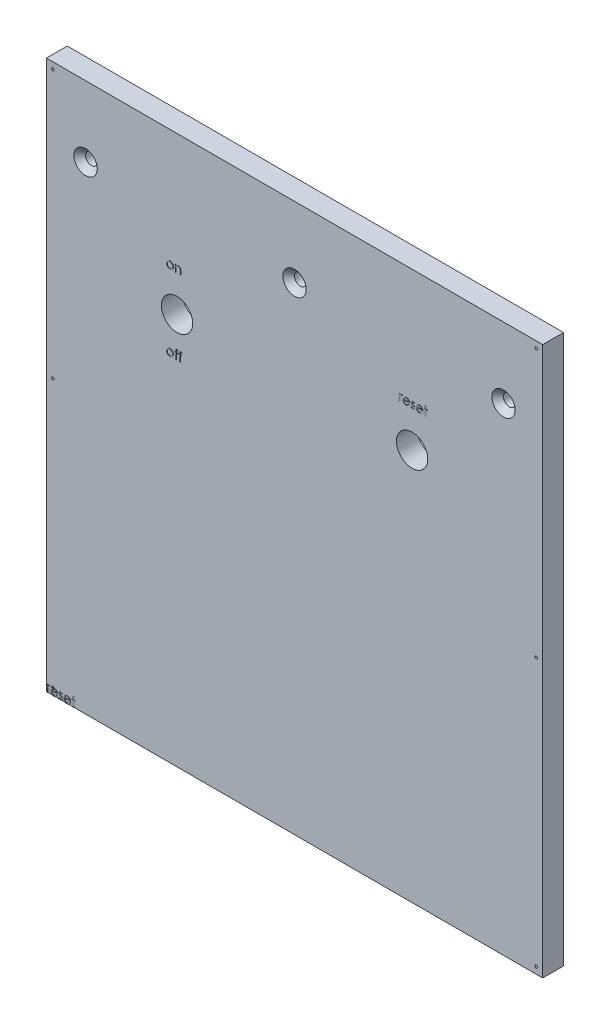
from build123d import *

# Parameters (mm, degrees)
ESBO_O1_W                            = 190
ESBO_O1_H                            = 210
RESSALTO_EXTRUS_O1_DEPTH             = 8
ESBO_O2_R                            = 6
CORTE_EXTRUS_O1_DEPTH                = 284.309018565
FURO_DE_DI_METRO_1_0_1_1_D           = 1
ESCAREADO_PARA_SFHCS_M41_D           = 4.5
ESCAREADO_PARA_SFHCS_M41_CSINK_D     = 8.96
ESCAREADO_PARA_SFHCS_M41_CSINK_ANGLE = 90
RESSALTO_EXTRUS_O3_DEPTH             = 0.1


with BuildPart() as part:
    # Esboço1 → Ressalto-extrusão1 (new body)
    with BuildSketch(Plane.XY):
        with Locations((95, 105)):
            Rectangle(ESBO_O1_W, ESBO_O1_H)
    extrude(amount=RESSALTO_EXTRUS_O1_DEPTH)

    # Esboço2 → Corte-extrusão1 (cut, through all)
    with BuildSketch(Plane.XY.offset(8)):
        with Locations((50, 150)):
            Circle(ESBO_O2_R)
        with Locations((140, 150)):
            Circle(ESBO_O2_R)
    extrude(amount=-CORTE_EXTRUS_O1_DEPTH, mode=Mode.SUBTRACT)

    # Furo de diâmetro Ø1.0 (1)1 (through all)
    with Locations(Plane(origin=(2.5, 207.5, 8), x_dir=(1, 0, 0), z_dir=(0, 0, 1))):
        with Locations((0, 0), (0, -102.5), (185, 0), (185, -102.5), (0, -205), (185, -205)):
            Hole(FURO_DE_DI_METRO_1_0_1_1_D / 2)

    # Escareado para SFHCS M41 (through all)
    with Locations(Plane(origin=(15, 183, 8), x_dir=(1, 0, 0), z_dir=(0, 0, 1))):
        with Locations((0, 0), (80, 0), (160, 0)):
            CounterSinkHole(ESCAREADO_PARA_SFHCS_M41_D / 2, ESCAREADO_PARA_SFHCS_M41_CSINK_D / 2, counter_sink_angle=ESCAREADO_PARA_SFHCS_M41_CSINK_ANGLE)

    # Esboço7 → Ressalto-extrusão3 (add)
    # profile 1 of 15: a face of its own
    with BuildSketch(Plane.XY.offset(8)):
        with BuildLine():
            add(Edge.make_bspline(
                [(47.306014312, 166.397993126), (47.354005584, 166.396971235), (47.448104742, 166.394967557), (47.585912628, 166.373552591), (47.717457764, 166.340805227), (47.843243956, 166.295533664), (47.961660251, 166.234851714), (48.074431495, 166.162442423), (48.181248504, 166.076659829), (48.245271534, 166.010301761), (48.277769119, 165.976618928)],
                knots=[0, 0, 0, 0, 1.054011418, 2.066658804, 3.057071809, 4.030435133, 4.997543892, 5.974964718, 6.972108034, 8, 8, 8, 8], degree=3))
            add(Edge.make_bspline(
                [(48.277769119, 165.976618928), (48.305751073, 165.944404942), (48.361173454, 165.8806004), (48.432239172, 165.777144787), (48.493460732, 165.670004686), (48.542523693, 165.55775736), (48.581208717, 165.441382688), (48.608674413, 165.320480677), (48.625011348, 165.19531833), (48.627214315, 165.110314492), (48.628330017, 165.06726396)],
                knots=[0, 0, 0, 0, 1.025258237, 2.030674902, 3.01204498, 3.988269485, 4.97094183, 5.956517959, 6.965070386, 8, 8, 8, 8], degree=3))
            add(Edge.make_bspline(
                [(48.628330017, 165.06726396), (48.627348679, 165.023963902), (48.625409511, 164.938400969), (48.607065895, 164.812381603), (48.578534809, 164.69018678), (48.537702971, 164.572328087), (48.485344861, 164.458445259), (48.421454174, 164.34903571), (48.345582557, 164.243883577), (48.25957856, 164.143881738), (48.164526684, 164.051715524), (48.061410535, 163.971387254), (47.952256502, 163.90256573), (47.835613148, 163.847129314), (47.712545662, 163.803419614), (47.582788593, 163.772719597), (47.446543523, 163.754157914), (47.353516302, 163.75177434), (47.306014312, 163.750557229)],
                knots=[0, 0, 0, 0, 0.998656419, 1.973391657, 2.932242238, 3.890759089, 4.846373663, 5.82037756, 6.809684879, 7.83454468, 8.860553229, 9.859544525, 10.845671541, 11.83227036, 12.833544569, 13.85385346, 14.904124723, 16, 16, 16, 16], degree=3))
            add(Edge.make_bspline(
                [(47.306014312, 163.750557229), (47.258279592, 163.751778425), (47.164788732, 163.7541702), (47.02806275, 163.772647482), (46.898073131, 163.803405465), (46.774844533, 163.847272958), (46.657699686, 163.902567502), (46.547913189, 163.971179191), (46.444713273, 164.051739346), (46.349641289, 164.143875283), (46.263642684, 164.24388524), (46.187769675, 164.349035278), (46.123879349, 164.458445372), (46.071521145, 164.572328057), (46.030689332, 164.690186788), (46.00215824, 164.812381601), (45.983814625, 164.938400969), (45.981875457, 165.023963902), (45.980894119, 165.06726396)],
                knots=[0, 0, 0, 0, 1.099876186, 2.154163076, 3.173186993, 4.173200201, 5.163417411, 6.152872554, 7.150605724, 8.17532212, 9.198891216, 10.186952605, 11.159729845, 12.11414092, 13.071450619, 14.029093627, 15.002601286, 16, 16, 16, 16], degree=3))
            add(Edge.make_bspline(
                [(45.980894119, 165.06726396), (45.98201743, 165.110080506), (45.984241391, 165.194849908), (46.0005619, 165.319776969), (46.027920457, 165.440474358), (46.066651853, 165.556399834), (46.116167044, 165.66815527), (46.176528332, 165.775560101), (46.248318964, 165.878547901), (46.303520916, 165.942269981), (46.331455017, 165.974515562)],
                knots=[0, 0, 0, 0, 1.031353054, 2.041901799, 3.029428768, 4.008703097, 4.981709435, 5.96992636, 6.972712378, 8, 8, 8, 8], degree=3))
            add(Edge.make_bspline(
                [(46.331455017, 165.974515562), (46.363903608, 166.008490502), (46.427719472, 166.075308198), (46.535068199, 166.160840722), (46.64756202, 166.234756796), (46.767286946, 166.294233011), (46.892969804, 166.341071529), (47.025189047, 166.373637044), (47.163464562, 166.394890399), (47.258024184, 166.396948577), (47.306014312, 166.397993126)],
                knots=[0, 0, 0, 0, 1.027980169, 2.021703884, 2.998553061, 3.971491411, 4.943284454, 5.930300938, 6.949603206, 8, 8, 8, 8], degree=3))
        make_face()
        with BuildLine():
            add(Edge.make_bspline(
                [(47.304612068, 166.083890562), (47.270674457, 166.082925971), (47.203675328, 166.081021688), (47.105055743, 166.066537783), (47.010115589, 166.043590279), (46.918674745, 166.010986223), (46.831041573, 165.968887324), (46.74713217, 165.917178964), (46.66669973, 165.856546008), (46.591317667, 165.787083336), (46.522135355, 165.711204341), (46.461657378, 165.630355982), (46.410232272, 165.545849636), (46.367392113, 165.457597425), (46.335484925, 165.364705011), (46.312311902, 165.26822438), (46.297841662, 165.167958963), (46.295955283, 165.099797945), (46.294996683, 165.065160594)],
                knots=[0, 0, 0, 0, 1.021534396, 2.016698045, 2.994645724, 3.958388632, 4.93408049, 5.916473867, 6.921342795, 7.962252576, 8.998418191, 10.008913653, 10.997312074, 11.973003931, 12.956656626, 13.948281152, 14.957379055, 16, 16, 16, 16], degree=3))
            add(Edge.make_bspline(
                [(46.294996683, 165.065160594), (46.296603507, 165.020408567), (46.299792751, 164.931584162), (46.325727988, 164.800773039), (46.369114268, 164.675191187), (46.427701547, 164.555574801), (46.501107766, 164.444902523), (46.587594833, 164.346231039), (46.686234533, 164.261045227), (46.795851033, 164.190364382), (46.914205351, 164.134204626), (47.039461672, 164.09440565), (47.170102366, 164.068533958), (47.259383098, 164.065962483), (47.304612068, 164.064659793)],
                knots=[0, 0, 0, 0, 1.016792936, 2.018143844, 3.017858371, 4.030088057, 5.03801393, 6.028138512, 7.003788237, 7.991172063, 8.984598303, 9.972568034, 10.972917682, 12, 12, 12, 12], degree=3))
            add(Edge.make_bspline(
                [(47.304612068, 164.064659793), (47.349838437, 164.065970073), (47.439114033, 164.06855653), (47.56957321, 164.09427535), (47.694487182, 164.134379011), (47.812718569, 164.190301221), (47.922285172, 164.261313635), (48.021634294, 164.345750012), (48.107382905, 164.445163864), (48.18071651, 164.555721393), (48.240263253, 164.675005745), (48.283446454, 164.800796217), (48.30944404, 164.931578259), (48.312624869, 165.02040659), (48.314227453, 165.065160594)],
                knots=[0, 0, 0, 0, 1.02726834, 2.027799167, 3.010890988, 4.004497153, 4.992059811, 5.971914811, 6.958719428, 7.966827853, 8.981595046, 9.981490638, 10.983022906, 12, 12, 12, 12], degree=3))
            add(Edge.make_bspline(
                [(48.314227453, 165.065160594), (48.313269183, 165.099798152), (48.311383453, 165.167959578), (48.296908489, 165.268222031), (48.273752949, 165.364713628), (48.241781332, 165.457565631), (48.199127318, 165.546078136), (48.146710525, 165.630107863), (48.0864795, 165.711484409), (48.016462379, 165.78683805), (47.941159001, 165.856573086), (47.860693963, 165.917202475), (47.776908984, 165.968660071), (47.689530402, 166.011346312), (47.598077834, 166.043293652), (47.503270705, 166.066670283), (47.405071895, 166.08096048), (47.338312852, 166.082907621), (47.304612068, 166.083890562)],
                knots=[0, 0, 0, 0, 1.042956736, 2.052379634, 3.044323526, 4.02829302, 5.004299113, 5.996692471, 7.007513377, 8.048758398, 9.090003419, 10.095195979, 11.07790575, 12.047570684, 13.018257071, 13.989683339, 14.985167495, 16, 16, 16, 16], degree=3))
        make_face(mode=Mode.SUBTRACT)
    # profile 2 of 15: a face of its own
    with BuildSketch(Plane.XY.offset(8)):
        with BuildLine():
            Line((49.256535145, 166.353121332), (49.570637709, 166.353121332))
            Line((49.570637709, 166.353121332), (49.570637709, 165.891783191))
            add(Edge.make_bspline(
                [(49.570637709, 165.891783191), (49.604175344, 165.933625913), (49.669256295, 166.014823177), (49.777640628, 166.121543751), (49.892184529, 166.209488977), (50.012186532, 166.27959277), (50.137809542, 166.332439397), (50.268287812, 166.370605328), (50.404402518, 166.393490156), (50.496966955, 166.396480387), (50.54379476, 166.397993126)],
                knots=[0, 0, 0, 0, 1.12780773, 2.188550248, 3.19190651, 4.159438251, 5.104880172, 6.052711206, 7.014878035, 8, 8, 8, 8], degree=3))
            add(Edge.make_bspline(
                [(50.54379476, 166.397993126), (50.591125394, 166.396247931), (50.683762862, 166.392832163), (50.818640923, 166.365815471), (50.944614317, 166.319670216), (51.061233873, 166.256458146), (51.166361086, 166.177851673), (51.258685938, 166.086273891), (51.335049185, 165.980937808), (51.386246548, 165.883214651), (51.419972196, 165.796525857), (51.441204533, 165.722279107), (51.459235515, 165.639560956), (51.474867263, 165.548621367), (51.485444375, 165.448823176), (51.493786666, 165.340575484), (51.499765361, 165.223913354), (51.500002568, 165.143226727), (51.500124888, 165.101618928)],
                knots=[0, 0, 0, 0, 1.235846778, 2.418850247, 3.575807741, 4.728682307, 5.871620074, 6.994088408, 8.11269785, 9.256955736, 9.865816715, 10.540099792, 11.271859618, 12.076849838, 12.949306005, 13.892391288, 14.913166135, 16, 16, 16, 16], degree=3))
            Line((51.500124888, 165.101618928), (51.500124888, 163.795429024))
            Line((51.500124888, 163.795429024), (51.186022324, 163.795429024))
            Line((51.186022324, 163.795429024), (51.186022324, 164.998554024))
            add(Edge.make_bspline(
                [(51.186022324, 164.998554024), (51.185829116, 165.033376469), (51.185459542, 165.09998588), (51.184293896, 165.195354903), (51.181484089, 165.281841481), (51.177535776, 165.359238849), (51.171756746, 165.427472685), (51.165734114, 165.486681962), (51.158369137, 165.536791504), (51.151806224, 165.566956587), (51.148862869, 165.580485114)],
                knots=[0, 0, 0, 0, 1.430800155, 2.736877192, 3.918605307, 4.986035426, 5.920637409, 6.731861385, 7.431261377, 8, 8, 8, 8], degree=3))
            add(Edge.make_bspline(
                [(51.148862869, 165.580485114), (51.138237338, 165.620196299), (51.117786477, 165.696628043), (51.067252494, 165.800302396), (51.003438313, 165.888500584), (50.925540464, 165.960677305), (50.834311388, 166.016848142), (50.730004245, 166.055822097), (50.613625605, 166.080198366), (50.531771222, 166.082625498), (50.48910726, 166.083890562)],
                knots=[0, 0, 0, 0, 1.084156227, 2.086665306, 3.027808233, 3.945421172, 4.874247719, 5.839848303, 6.874090471, 8, 8, 8, 8], degree=3))
            add(Edge.make_bspline(
                [(50.48910726, 166.083890562), (50.463839577, 166.083414558), (50.413835484, 166.082472557), (50.339685512, 166.073021259), (50.267761339, 166.057562803), (50.19734113, 166.036694166), (50.129833336, 166.008031896), (50.063069045, 165.975502526), (49.999562281, 165.934954314), (49.937958883, 165.889763693), (49.880646076, 165.839684486), (49.827317737, 165.786839975), (49.779779717, 165.730564372), (49.736711042, 165.671764424), (49.699532778, 165.609632586), (49.66707969, 165.54476828), (49.639543996, 165.477086131), (49.625861303, 165.43011107), (49.619015113, 165.406606909)],
                knots=[0, 0, 0, 0, 1.023777757, 2.026029729, 3.023749952, 4.003683103, 4.997618607, 5.993177895, 7.010360494, 8.046726602, 9.087585522, 10.09234134, 11.086953743, 12.070360549, 13.043493632, 14.017870808, 15.008233677, 16, 16, 16, 16], degree=3))
            add(Edge.make_bspline(
                [(49.619015113, 165.406606909), (49.615075464, 165.389351705), (49.606499055, 165.351788031), (49.597235876, 165.290143612), (49.5888283, 165.218833637), (49.581791341, 165.13794132), (49.577485925, 165.047183445), (49.572791528, 164.946947607), (49.571082467, 164.836834118), (49.570790113, 164.760172426), (49.570637709, 164.720208671)],
                knots=[0, 0, 0, 0, 0.615963638, 1.340920617, 2.168419149, 3.115676021, 4.16674242, 5.331190069, 6.6087489, 8, 8, 8, 8], degree=3))
            Line((49.570637709, 164.720208671), (49.570637709, 163.795429024))
            Line((49.570637709, 163.795429024), (49.256535145, 163.795429024))
            Line((49.256535145, 163.795429024), (49.256535145, 166.353121332))
        make_face()
    # profile 3 of 15: a face of its own
    with BuildSketch(Plane.XY.offset(8)):
        with BuildLine():
            add(Edge.make_bspline(
                [(47.306014312, 137.377467158), (47.354005584, 137.376445267), (47.448104742, 137.374441588), (47.585912628, 137.353026622), (47.717457764, 137.320279258), (47.843243956, 137.275007696), (47.961660251, 137.214325745), (48.074431495, 137.141916454), (48.181248504, 137.056133861), (48.245271534, 136.989775792), (48.277769119, 136.956092959)],
                knots=[0, 0, 0, 0, 1.054011418, 2.066658804, 3.057071809, 4.030435133, 4.997543892, 5.974964718, 6.972108034, 8, 8, 8, 8], degree=3))
            add(Edge.make_bspline(
                [(48.277769119, 136.956092959), (48.305751073, 136.923878973), (48.361173454, 136.860074431), (48.432239172, 136.756618818), (48.493460732, 136.649478718), (48.542523693, 136.537231391), (48.581208717, 136.42085672), (48.608674413, 136.299954709), (48.625011348, 136.174792361), (48.627214315, 136.089788523), (48.628330017, 136.046737991)],
                knots=[0, 0, 0, 0, 1.025258237, 2.030674902, 3.01204498, 3.988269485, 4.97094183, 5.956517959, 6.965070386, 8, 8, 8, 8], degree=3))
            add(Edge.make_bspline(
                [(48.628330017, 136.046737991), (48.627348679, 136.003437933), (48.625409511, 135.917875), (48.607065895, 135.791855634), (48.578534809, 135.669660812), (48.537702971, 135.551802118), (48.485344861, 135.437919291), (48.421454174, 135.328509741), (48.345582557, 135.223357608), (48.25957856, 135.12335577), (48.164526684, 135.031189555), (48.061410535, 134.950861285), (47.952256502, 134.882039761), (47.835613148, 134.826603345), (47.712545662, 134.782893645), (47.582788593, 134.752193629), (47.446543523, 134.733631945), (47.353516302, 134.731248372), (47.306014312, 134.73003126)],
                knots=[0, 0, 0, 0, 0.998656419, 1.973391657, 2.932242238, 3.890759089, 4.846373663, 5.82037756, 6.809684879, 7.83454468, 8.860553229, 9.859544525, 10.845671541, 11.83227036, 12.833544569, 13.85385346, 14.904124723, 16, 16, 16, 16], degree=3))
            add(Edge.make_bspline(
                [(47.306014312, 134.73003126), (47.258279592, 134.731252457), (47.164788732, 134.733644231), (47.02806275, 134.752121514), (46.898073131, 134.782879496), (46.774844533, 134.826746989), (46.657699686, 134.882041533), (46.547913189, 134.950653222), (46.444713273, 135.031213378), (46.349641289, 135.123349315), (46.263642684, 135.223359271), (46.187769675, 135.32850931), (46.123879349, 135.437919403), (46.071521145, 135.551802088), (46.030689332, 135.66966082), (46.00215824, 135.791855632), (45.983814625, 135.917875001), (45.981875457, 136.003437934), (45.980894119, 136.046737991)],
                knots=[0, 0, 0, 0, 1.099876186, 2.154163076, 3.173186993, 4.173200201, 5.163417411, 6.152872554, 7.150605724, 8.17532212, 9.198891216, 10.186952605, 11.159729845, 12.11414092, 13.071450619, 14.029093627, 15.002601286, 16, 16, 16, 16], degree=3))
            add(Edge.make_bspline(
                [(45.980894119, 136.046737991), (45.98201743, 136.089554537), (45.984241391, 136.174323939), (46.0005619, 136.299251), (46.027920457, 136.419948389), (46.066651853, 136.535873865), (46.116167044, 136.647629301), (46.176528332, 136.755034132), (46.248318964, 136.858021933), (46.303520916, 136.921744013), (46.331455017, 136.953989594)],
                knots=[0, 0, 0, 0, 1.031353054, 2.041901799, 3.029428768, 4.008703097, 4.981709435, 5.96992636, 6.972712378, 8, 8, 8, 8], degree=3))
            add(Edge.make_bspline(
                [(46.331455017, 136.953989594), (46.363903608, 136.987964533), (46.427719472, 137.054782229), (46.535068199, 137.140314753), (46.64756202, 137.214230827), (46.767286946, 137.273707043), (46.892969804, 137.32054556), (47.025189047, 137.353111075), (47.163464562, 137.37436443), (47.258024184, 137.376422608), (47.306014312, 137.377467158)],
                knots=[0, 0, 0, 0, 1.027980169, 2.021703884, 2.998553061, 3.971491411, 4.943284454, 5.930300938, 6.949603206, 8, 8, 8, 8], degree=3))
        make_face()
        with BuildLine():
            add(Edge.make_bspline(
                [(47.304612068, 137.063364594), (47.270674457, 137.062400002), (47.203675328, 137.060495719), (47.105055743, 137.046011815), (47.010115589, 137.023064311), (46.918674745, 136.990460254), (46.831041573, 136.948361356), (46.74713217, 136.896652995), (46.66669973, 136.836020039), (46.591317667, 136.766557367), (46.522135355, 136.690678373), (46.461657378, 136.609830014), (46.410232272, 136.525323668), (46.367392113, 136.437071456), (46.335484925, 136.344179042), (46.312311902, 136.247698411), (46.297841662, 136.147432995), (46.295955283, 136.079271976), (46.294996683, 136.044634626)],
                knots=[0, 0, 0, 0, 1.021534396, 2.016698045, 2.994645724, 3.958388632, 4.93408049, 5.916473867, 6.921342795, 7.962252576, 8.998418191, 10.008913653, 10.997312074, 11.973003931, 12.956656626, 13.948281152, 14.957379055, 16, 16, 16, 16], degree=3))
            add(Edge.make_bspline(
                [(46.294996683, 136.044634626), (46.296603507, 135.999882599), (46.299792751, 135.911058193), (46.325727988, 135.78024707), (46.369114268, 135.654665218), (46.427701547, 135.535048832), (46.501107766, 135.424376554), (46.587594833, 135.32570507), (46.686234533, 135.240519258), (46.795851033, 135.169838413), (46.914205351, 135.113678657), (47.039461672, 135.073879681), (47.170102366, 135.048007989), (47.259383098, 135.045436515), (47.304612068, 135.044133824)],
                knots=[0, 0, 0, 0, 1.016792936, 2.018143844, 3.017858371, 4.030088057, 5.03801393, 6.028138512, 7.003788237, 7.991172063, 8.984598303, 9.972568034, 10.972917682, 12, 12, 12, 12], degree=3))
            add(Edge.make_bspline(
                [(47.304612068, 135.044133824), (47.349838437, 135.045444105), (47.439114033, 135.048030562), (47.56957321, 135.073749381), (47.694487182, 135.113853042), (47.812718569, 135.169775252), (47.922285172, 135.240787667), (48.021634294, 135.325224044), (48.107382905, 135.424637895), (48.18071651, 135.535195424), (48.240263253, 135.654479776), (48.283446454, 135.780270248), (48.30944404, 135.91105229), (48.312624869, 135.999880621), (48.314227453, 136.044634626)],
                knots=[0, 0, 0, 0, 1.02726834, 2.027799167, 3.010890988, 4.004497153, 4.992059811, 5.971914811, 6.958719428, 7.966827853, 8.981595046, 9.981490638, 10.983022906, 12, 12, 12, 12], degree=3))
            add(Edge.make_bspline(
                [(48.314227453, 136.044634626), (48.313269183, 136.079272183), (48.311383453, 136.147433609), (48.296908489, 136.247696063), (48.273752949, 136.344187659), (48.241781332, 136.437039663), (48.199127318, 136.525552167), (48.146710525, 136.609581894), (48.0864795, 136.69095844), (48.016462379, 136.766312081), (47.941159001, 136.836047117), (47.860693963, 136.896676507), (47.776908984, 136.948134102), (47.689530402, 136.990820343), (47.598077834, 137.022767683), (47.503270705, 137.046144315), (47.405071895, 137.060434511), (47.338312852, 137.062381653), (47.304612068, 137.063364594)],
                knots=[0, 0, 0, 0, 1.042956736, 2.052379634, 3.044323526, 4.02829302, 5.004299113, 5.996692471, 7.007513377, 8.048758398, 9.090003419, 10.095195979, 11.07790575, 12.047570684, 13.018257071, 13.989683339, 14.985167495, 16, 16, 16, 16], degree=3))
        make_face(mode=Mode.SUBTRACT)
    # profile 4 of 15: a face of its own
    with BuildSketch(Plane.XY.offset(8)):
        with BuildLine():
            Line((50.333458222, 138.343612991), (50.333458222, 138.016890235))
            add(Edge.make_bspline(
                [(50.333458222, 138.016890235), (50.303719443, 138.028841107), (50.247274622, 138.051524111), (50.164034246, 138.076188736), (50.087505412, 138.092124477), (50.038351522, 138.094360421), (50.015148927, 138.095415876)],
                knots=[0, 0, 0, 0, 1.16548392, 2.212112691, 3.15604595, 4, 4, 4, 4], degree=3))
            add(Edge.make_bspline(
                [(50.015148927, 138.095415876), (49.999475163, 138.094764536), (49.969135984, 138.093503758), (49.925532657, 138.087075483), (49.886243447, 138.073972682), (49.851337827, 138.056943405), (49.822387367, 138.035589221), (49.797601142, 138.014133957), (49.779634613, 137.989948777), (49.769879665, 137.967428367), (49.763929664, 137.946577373), (49.762139536, 137.925223107), (49.757754622, 137.898999021), (49.756531815, 137.866835303), (49.753744447, 137.829732592), (49.753991088, 137.786905696), (49.751707165, 137.739028553), (49.752049079, 137.705128004), (49.752228254, 137.687362991)],
                knots=[0, 0, 0, 0, 1.311993654, 2.539582093, 3.670788641, 4.763509788, 5.772417512, 6.671800701, 7.496729179, 8.266799162, 8.712543678, 9.304149002, 10.05334463, 10.934920737, 11.99209668, 13.165090968, 14.514413552, 16, 16, 16, 16], degree=3))
            Line((49.752228254, 137.687362991), (49.752228254, 137.332595363))
            Line((49.752228254, 137.332595363), (50.288586427, 137.332595363))
            Line((50.288586427, 137.332595363), (50.288586427, 137.018492799))
            Line((50.288586427, 137.018492799), (49.751527132, 137.018492799))
            Line((49.751527132, 137.018492799), (49.750124888, 134.774903055))
            Line((49.750124888, 134.774903055), (49.436022324, 134.774903055))
            Line((49.436022324, 134.774903055), (49.436022324, 137.018492799))
            Line((49.436022324, 137.018492799), (49.077047965, 137.018492799))
            Line((49.077047965, 137.018492799), (49.077047965, 137.332595363))
            Line((49.077047965, 137.332595363), (49.436022324, 137.332595363))
            Line((49.436022324, 137.332595363), (49.436022324, 137.741349369))
            add(Edge.make_bspline(
                [(49.436022324, 137.741349369), (49.436047539, 137.764024949), (49.43609591, 137.807525854), (49.439483761, 137.870135294), (49.442379481, 137.927958758), (49.448147109, 137.980547391), (49.454808815, 138.028393534), (49.464344974, 138.070786415), (49.473356346, 138.108868174), (49.489704938, 138.151970831), (49.514127157, 138.200820856), (49.553657353, 138.252444755), (49.601050361, 138.298749702), (49.657658685, 138.337757055), (49.72137422, 138.370172533), (49.792255398, 138.393414386), (49.869530596, 138.406554831), (49.923018066, 138.40850904), (49.950645722, 138.40951844)],
                knots=[0, 0, 0, 0, 1.116398763, 2.141702935, 3.087165306, 3.966655413, 4.746276475, 5.464069668, 6.106083417, 6.67047701, 7.730773247, 8.782666744, 9.856985883, 10.980834087, 12.154321827, 13.366232824, 14.639591414, 16, 16, 16, 16], degree=3))
            add(Edge.make_bspline(
                [(49.950645722, 138.40951844), (49.97872248, 138.408561059), (50.037668144, 138.406551089), (50.129864747, 138.394117682), (50.229461264, 138.372646652), (50.297797185, 138.353568768), (50.333458222, 138.343612991)],
                knots=[0, 0, 0, 0, 0.864728408, 1.815451418, 2.859995356, 4, 4, 4, 4], degree=3))
        make_face()
    # profile 5 of 15: a face of its own
    with BuildSketch(Plane.XY.offset(8)):
        with BuildLine():
            Line((51.859099247, 138.343612991), (51.859099247, 138.016890235))
            add(Edge.make_bspline(
                [(51.859099247, 138.016890235), (51.829360468, 138.028841107), (51.772915647, 138.051524111), (51.689675271, 138.076188736), (51.613146438, 138.092124477), (51.563992547, 138.094360421), (51.540789953, 138.095415876)],
                knots=[0, 0, 0, 0, 1.16548392, 2.212112691, 3.15604595, 4, 4, 4, 4], degree=3))
            add(Edge.make_bspline(
                [(51.540789953, 138.095415876), (51.525116188, 138.094764536), (51.494777009, 138.093503758), (51.451173683, 138.087075483), (51.411884473, 138.073972682), (51.376978852, 138.056943405), (51.348028392, 138.035589221), (51.323242168, 138.014133957), (51.305275638, 137.989948777), (51.295520691, 137.967428367), (51.28957069, 137.946577373), (51.287780562, 137.925223107), (51.283395648, 137.898999021), (51.282172841, 137.866835303), (51.279385472, 137.829732592), (51.279632114, 137.786905696), (51.277348191, 137.739028553), (51.277690105, 137.705128004), (51.277869279, 137.687362991)],
                knots=[0, 0, 0, 0, 1.311993654, 2.539582093, 3.670788641, 4.763509788, 5.772417512, 6.671800701, 7.496729179, 8.266799162, 8.712543678, 9.304149002, 10.05334463, 10.934920737, 11.99209668, 13.165090968, 14.514413552, 16, 16, 16, 16], degree=3))
            Line((51.277869279, 137.687362991), (51.277869279, 137.332595363))
            Line((51.277869279, 137.332595363), (51.814227453, 137.332595363))
            Line((51.814227453, 137.332595363), (51.814227453, 137.018492799))
            Line((51.814227453, 137.018492799), (51.277168158, 137.018492799))
            Line((51.277168158, 137.018492799), (51.275765914, 134.774903055))
            Line((51.275765914, 134.774903055), (50.96166335, 134.774903055))
            Line((50.96166335, 134.774903055), (50.96166335, 137.018492799))
            Line((50.96166335, 137.018492799), (50.602688991, 137.018492799))
            Line((50.602688991, 137.018492799), (50.602688991, 137.332595363))
            Line((50.602688991, 137.332595363), (50.96166335, 137.332595363))
            Line((50.96166335, 137.332595363), (50.96166335, 137.741349369))
            add(Edge.make_bspline(
                [(50.96166335, 137.741349369), (50.961688564, 137.764024949), (50.961736936, 137.807525854), (50.965124787, 137.870135294), (50.968020507, 137.927958758), (50.973788135, 137.980547391), (50.980449841, 138.028393534), (50.989986, 138.070786415), (50.998997371, 138.108868174), (51.015345963, 138.151970831), (51.039768183, 138.200820856), (51.079298379, 138.252444755), (51.126691387, 138.298749702), (51.18329971, 138.337757055), (51.247015245, 138.370172533), (51.317896424, 138.393414386), (51.395171621, 138.406554831), (51.448659091, 138.40850904), (51.476286747, 138.40951844)],
                knots=[0, 0, 0, 0, 1.116398763, 2.141702935, 3.087165306, 3.966655413, 4.746276475, 5.464069668, 6.106083417, 6.67047701, 7.730773247, 8.782666744, 9.856985883, 10.980834087, 12.154321827, 13.366232824, 14.639591414, 16, 16, 16, 16], degree=3))
            add(Edge.make_bspline(
                [(51.476286747, 138.40951844), (51.504363506, 138.408561059), (51.56330917, 138.406551089), (51.655505772, 138.394117682), (51.75510229, 138.372646652), (51.823438211, 138.353568768), (51.859099247, 138.343612991)],
                knots=[0, 0, 0, 0, 0.864728408, 1.815451418, 2.859995356, 4, 4, 4, 4], degree=3))
        make_face()
    # profile 6 of 15: a face of its own
    with BuildSketch(Plane.XY.offset(8)):
        with BuildLine():
            Line((0.269230769, 2.557692308), (0.583333333, 2.557692308))
            Line((0.583333333, 2.557692308), (0.583333333, 2.181189904))
            add(Edge.make_bspline(
                [(0.583333333, 2.181189904), (0.606522092, 2.216245732), (0.650870413, 2.283289731), (0.724583342, 2.371959032), (0.800086674, 2.445374079), (0.877741861, 2.503877598), (0.958119961, 2.547690717), (1.039456913, 2.579783752), (1.123032382, 2.598761067), (1.179194307, 2.601294726), (1.207331731, 2.602564103)],
                knots=[0, 0, 0, 0, 1.2804753, 2.448899062, 3.506932113, 4.484331642, 5.4025378, 6.288909075, 7.142734305, 8, 8, 8, 8], degree=3))
            add(Edge.make_bspline(
                [(1.207331731, 2.602564103), (1.229158057, 2.601373576), (1.274067142, 2.59892399), (1.342049732, 2.581713165), (1.412093184, 2.554235143), (1.457235571, 2.52839492), (1.480769231, 2.514923878)],
                knots=[0, 0, 0, 0, 0.901110191, 1.854092781, 2.881294221, 4, 4, 4, 4], degree=3))
            Line((1.480769231, 2.514923878), (1.308293269, 2.242888622))
            add(Edge.make_bspline(
                [(1.308293269, 2.242888622), (1.293184248, 2.249628888), (1.264504434, 2.262423203), (1.222549867, 2.277565213), (1.183868531, 2.286481129), (1.159224972, 2.287831847), (1.147736378, 2.288461538)],
                knots=[0, 0, 0, 0, 1.180555205, 2.24091978, 3.179933427, 4, 4, 4, 4], degree=3))
            add(Edge.make_bspline(
                [(1.147736378, 2.288461538), (1.122530645, 2.286781501), (1.071118255, 2.283354712), (0.995633755, 2.256415904), (0.92238655, 2.212890664), (0.864214887, 2.164619552), (0.819172635, 2.118071755), (0.787032409, 2.077423352), (0.757549662, 2.031844721), (0.729379442, 1.982115037), (0.703713148, 1.927385191), (0.679758478, 1.868201977), (0.658099615, 1.804496849), (0.645749371, 1.760114328), (0.639423077, 1.737379808)],
                knots=[0, 0, 0, 0, 1.125678352, 2.296057538, 3.5422874, 4.923748041, 5.663163013, 6.437101912, 7.23742474, 8.08941207, 8.991984279, 9.93940061, 10.944477711, 12, 12, 12, 12], degree=3))
            add(Edge.make_bspline(
                [(0.639423077, 1.737379808), (0.634690684, 1.717102634), (0.624208792, 1.672190235), (0.614017254, 1.596841711), (0.603947736, 1.507818052), (0.596851118, 1.404871459), (0.590273076, 1.288259015), (0.586562993, 1.15780307), (0.583459853, 1.013369718), (0.583376786, 0.912395365), (0.583333333, 0.859575321)],
                knots=[0, 0, 0, 0, 0.566838948, 1.255505196, 2.06880316, 3.007127437, 4.065329342, 5.249902469, 6.561414163, 8, 8, 8, 8], degree=3))
            Line((0.583333333, 0.859575321), (0.583333333, 0))
            Line((0.583333333, 0), (0.269230769, 0))
            Line((0.269230769, 0), (0.269230769, 2.557692308))
        make_face()
    # profile 7 of 15: a face of its own
    with BuildSketch(Plane.XY.offset(8)):
        with BuildLine():
            Line((3.894030449, 0.807692308), (4.173076923, 0.661157853))
            add(Edge.make_bspline(
                [(4.173076923, 0.661157853), (4.150840328, 0.621714521), (4.107576719, 0.544973418), (4.033175971, 0.439541558), (3.955183899, 0.344693842), (3.870079931, 0.262964188), (3.780410252, 0.191712803), (3.685677597, 0.129374978), (3.585388779, 0.076256458), (3.479539055, 0.03150393), (3.367239503, -0.002905564), (3.248217987, -0.027209785), (3.122246492, -0.042233054), (3.035900312, -0.043978194), (2.991686699, -0.044871795)],
                knots=[0, 0, 0, 0, 1.120438281, 2.179929193, 3.190490725, 4.156257408, 5.095198341, 6.022838206, 6.959905092, 7.901321166, 8.864066838, 9.862729781, 10.905609505, 12, 12, 12, 12], degree=3))
            add(Edge.make_bspline(
                [(2.991686699, -0.044871795), (2.942544721, -0.04372462), (2.84668296, -0.041486813), (2.707143212, -0.022194348), (2.575763794, 0.00927801), (2.452552091, 0.053243552), (2.337809838, 0.110670876), (2.231308983, 0.180630358), (2.132489457, 0.262762612), (2.044465248, 0.357779056), (1.965221366, 0.459461013), (1.895295546, 0.565416898), (1.836838114, 0.675380122), (1.789285504, 0.788650646), (1.750880639, 0.90451454), (1.724113936, 1.024026007), (1.708684188, 1.146861592), (1.706319742, 1.229958927), (1.705128205, 1.271834936)],
                knots=[0, 0, 0, 0, 1.145258523, 2.234067595, 3.276747158, 4.290159414, 5.277019952, 6.260822364, 7.254936242, 8.264827045, 9.274100331, 10.257902744, 11.220704747, 12.172965371, 13.118907548, 14.062713208, 15.023725156, 16, 16, 16, 16], degree=3))
            add(Edge.make_bspline(
                [(1.705128205, 1.271834936), (1.706187346, 1.311129766), (1.708286425, 1.389006931), (1.721517212, 1.504272476), (1.744965505, 1.616300928), (1.777141829, 1.725185376), (1.818693075, 1.83074351), (1.869525295, 1.933039574), (1.929717672, 2.031964713), (1.976190346, 2.094367847), (1.999599359, 2.125801282)],
                knots=[0, 0, 0, 0, 1.024358464, 2.0301432, 3.019427413, 4.004406732, 4.986367066, 5.972626655, 6.978780325, 8, 8, 8, 8], degree=3))
            add(Edge.make_bspline(
                [(1.999599359, 2.125801282), (2.031307042, 2.163670152), (2.093717988, 2.238208303), (2.199274344, 2.336146628), (2.31357454, 2.418190404), (2.435186166, 2.48619754), (2.56552264, 2.537871187), (2.702831931, 2.576378769), (2.848677517, 2.59795678), (2.948382738, 2.601004614), (2.999399038, 2.602564103)],
                knots=[0, 0, 0, 0, 1.030682036, 2.02871468, 2.997146059, 3.962720338, 4.930598197, 5.918074684, 6.934738563, 8, 8, 8, 8], degree=3))
            add(Edge.make_bspline(
                [(2.999399038, 2.602564103), (3.051846644, 2.601210054), (3.15473689, 2.598553718), (3.304769011, 2.573927385), (3.446729727, 2.53487483), (3.580562232, 2.47972104), (3.706280092, 2.408561488), (3.823066142, 2.320419647), (3.932917654, 2.218001559), (3.996826233, 2.13923835), (4.029346955, 2.099158654)],
                knots=[0, 0, 0, 0, 1.056321875, 2.072262726, 3.055038591, 4.01806755, 4.982017516, 5.957941055, 6.960871419, 8, 8, 8, 8], degree=3))
            add(Edge.make_bspline(
                [(4.029346955, 2.099158654), (4.051473893, 2.068955072), (4.095580487, 2.008748954), (4.150827587, 1.910577797), (4.198784982, 1.807867202), (4.237117943, 1.698956905), (4.268157444, 1.585137325), (4.290614263, 1.46559478), (4.303783881, 1.340364869), (4.306372578, 1.255038314), (4.307692308, 1.211538462)],
                knots=[0, 0, 0, 0, 0.94817472, 1.890038105, 2.849395472, 3.817997239, 4.812318967, 5.836947057, 6.897266129, 8, 8, 8, 8], degree=3))
            Line((4.307692308, 1.211538462), (2.019230769, 1.211538462))
            add(Edge.make_bspline(
                [(2.019230769, 1.211538462), (2.020770376, 1.177837997), (2.02379795, 1.111567394), (2.037913093, 1.01459661), (2.060161867, 0.922223268), (2.091430929, 0.835140226), (2.129297774, 0.752210099), (2.175683491, 0.674048062), (2.231023045, 0.601010132), (2.292748745, 0.532442994), (2.36145584, 0.471382233), (2.433738587, 0.416730457), (2.510632152, 0.37092486), (2.591530236, 0.33374497), (2.676302021, 0.304638654), (2.764974216, 0.284770834), (2.857372332, 0.271463727), (2.920358066, 0.269984061), (2.952423878, 0.269230769)],
                knots=[0, 0, 0, 0, 1.094153842, 2.151609401, 3.174256925, 4.172055639, 5.149267565, 6.128595816, 7.11444997, 8.118368179, 9.117203808, 10.09244225, 11.054858984, 12.015122123, 12.976791628, 13.957293641, 14.960065497, 16, 16, 16, 16], degree=3))
            add(Edge.make_bspline(
                [(2.952423878, 0.269230769), (2.983775026, 0.269838826), (3.045981717, 0.271045327), (3.138622574, 0.282777238), (3.229762101, 0.301747513), (3.319023085, 0.327637504), (3.404593931, 0.359214356), (3.483839481, 0.397317213), (3.556719696, 0.43946696), (3.624836663, 0.487676635), (3.690907656, 0.546684822), (3.756450143, 0.620320543), (3.826726796, 0.707408071), (3.870716389, 0.772953737), (3.894030449, 0.807692308)],
                knots=[0, 0, 0, 0, 0.99110716, 1.966546729, 2.947904876, 3.932708344, 4.903319531, 5.828989031, 6.710028674, 7.56322171, 8.463672341, 9.504779593, 10.677557249, 12, 12, 12, 12], degree=3))
        make_face()
        with BuildLine():
            add(Edge.make_bspline(
                [(3.993589744, 1.525641026), (3.982093119, 1.567303899), (3.959965818, 1.64749152), (3.913729453, 1.75853241), (3.861657912, 1.857220311), (3.800036181, 1.942799944), (3.730217455, 2.018803457), (3.649572273, 2.085222043), (3.559136379, 2.144639494), (3.459377239, 2.194791993), (3.353735454, 2.237481852), (3.243129262, 2.266106968), (3.130271474, 2.28571651), (3.053937187, 2.287542618), (3.01552484, 2.288461538)],
                knots=[0, 0, 0, 0, 1.154881502, 2.222775134, 3.210006277, 4.132804581, 5.035138423, 5.962687519, 6.919655026, 7.923214229, 8.944639381, 9.960483929, 10.97369054, 12, 12, 12, 12], degree=3))
            add(Edge.make_bspline(
                [(3.01552484, 2.288461538), (2.984175401, 2.287849867), (2.922204152, 2.286640721), (2.830903084, 2.275170592), (2.743223385, 2.256210747), (2.658518097, 2.23024579), (2.577897229, 2.195637188), (2.499702461, 2.155053961), (2.425922065, 2.105512377), (2.379780769, 2.067753522), (2.356470353, 2.048677885)],
                knots=[0, 0, 0, 0, 1.04873581, 2.073130211, 3.073294108, 4.04793562, 5.032784715, 6.005352987, 6.992311501, 8, 8, 8, 8], degree=3))
            add(Edge.make_bspline(
                [(2.356470353, 2.048677885), (2.339777071, 2.033583569), (2.305993936, 2.003036353), (2.260853415, 1.950407146), (2.217632942, 1.893655584), (2.178299289, 1.83061046), (2.142221703, 1.761989681), (2.108461726, 1.688372045), (2.078075314, 1.609198915), (2.060979204, 1.554026476), (2.052183494, 1.525641026)],
                knots=[0, 0, 0, 0, 0.879870761, 1.780643979, 2.707998968, 3.669668524, 4.684282772, 5.740141944, 6.837334558, 8, 8, 8, 8], degree=3))
            Line((2.052183494, 1.525641026), (3.993589744, 1.525641026))
        make_face(mode=Mode.SUBTRACT)
    # profile 8 of 15: a face of its own
    with BuildSketch(Plane.XY.offset(8)):
        with BuildLine():
            Line((6.147435897, 2.238681891), (5.934294872, 2.019230769))
            add(Edge.make_bspline(
                [(5.934294872, 2.019230769), (5.915904368, 2.040543916), (5.880449642, 2.081633153), (5.824218161, 2.136570219), (5.768194558, 2.182707158), (5.713145744, 2.221659417), (5.657687475, 2.251108564), (5.602470557, 2.272603426), (5.547437819, 2.285905231), (5.510651783, 2.28761967), (5.492588141, 2.288461538)],
                knots=[0, 0, 0, 0, 1.26578478, 2.440284043, 3.530471711, 4.527705817, 5.468200915, 6.346673037, 7.188140097, 8, 8, 8, 8], degree=3))
            add(Edge.make_bspline(
                [(5.492588141, 2.288461538), (5.470448751, 2.287386665), (5.426881565, 2.285271468), (5.364455747, 2.264158037), (5.306505122, 2.231749299), (5.256348142, 2.185780715), (5.213860462, 2.133016446), (5.182846781, 2.074020122), (5.163880797, 2.010572078), (5.161476065, 1.96654222), (5.16025641, 1.944210737)],
                knots=[0, 0, 0, 0, 0.99966794, 1.967205029, 2.953328237, 3.988086729, 5.028030931, 6.008226631, 6.989793394, 8, 8, 8, 8], degree=3))
            add(Edge.make_bspline(
                [(5.16025641, 1.944210737), (5.161367223, 1.923998693), (5.163585716, 1.883631582), (5.180832395, 1.824083548), (5.208298467, 1.76602651), (5.233968661, 1.730463604), (5.247195513, 1.712139423)],
                knots=[0, 0, 0, 0, 0.960159726, 1.917612774, 2.927026955, 4, 4, 4, 4], degree=3))
            add(Edge.make_bspline(
                [(5.247195513, 1.712139423), (5.255159007, 1.702354839), (5.272108299, 1.681529584), (5.303916814, 1.652625731), (5.339939317, 1.62068348), (5.383259255, 1.588746643), (5.432010283, 1.555114918), (5.487249567, 1.521112785), (5.547224072, 1.48414836), (5.590161379, 1.460703924), (5.612479968, 1.448517628)],
                knots=[0, 0, 0, 0, 0.66740084, 1.420478572, 2.27185888, 3.217733974, 4.268547843, 5.408967954, 6.65319498, 8, 8, 8, 8], degree=3))
            add(Edge.make_bspline(
                [(5.612479968, 1.448517628), (5.639693545, 1.433272725), (5.692261215, 1.403824593), (5.766953982, 1.358114889), (5.834741023, 1.312683465), (5.896196691, 1.268016191), (5.9501385, 1.222863324), (5.998203052, 1.178955567), (6.039191496, 1.134966258), (6.062145423, 1.104233145), (6.073116987, 1.089543269)],
                knots=[0, 0, 0, 0, 1.27191281, 2.456916733, 3.569705269, 4.599008579, 5.553216877, 6.436649441, 7.252746552, 8, 8, 8, 8], degree=3))
            add(Edge.make_bspline(
                [(6.073116987, 1.089543269), (6.091327515, 1.059877181), (6.127569844, 1.00083616), (6.16562811, 0.903617733), (6.187688385, 0.80050723), (6.190750605, 0.72997501), (6.192307692, 0.694110577)],
                knots=[0, 0, 0, 0, 0.995354457, 1.980940102, 2.973342416, 4, 4, 4, 4], degree=3))
            add(Edge.make_bspline(
                [(6.192307692, 0.694110577), (6.191588158, 0.668841431), (6.190170239, 0.619045818), (6.180312172, 0.545710988), (6.163357195, 0.47557643), (6.140263441, 0.407881146), (6.109079068, 0.343922206), (6.072531271, 0.282085957), (6.028656359, 0.223710026), (5.978564984, 0.168871066), (5.92371949, 0.118785319), (5.865213352, 0.074761365), (5.802974521, 0.038187028), (5.73744772, 0.007921682), (5.668484065, -0.016146576), (5.596072776, -0.032809107), (5.520444022, -0.042781868), (5.469014213, -0.044166344), (5.442808494, -0.044871795)],
                knots=[0, 0, 0, 0, 1.032770009, 2.035186124, 3.017557409, 3.978232242, 4.952395191, 5.920591857, 6.910227898, 7.931268572, 8.952309245, 9.941945286, 10.918353717, 11.897095711, 12.887975737, 13.898235213, 14.929059601, 16, 16, 16, 16], degree=3))
            add(Edge.make_bspline(
                [(5.442808494, -0.044871795), (5.407441318, -0.043879095), (5.337198391, -0.041907487), (5.233308672, -0.023401426), (5.131787913, 0.005393968), (5.033404373, 0.045109902), (4.940358259, 0.095260615), (4.855227335, 0.155323008), (4.777715872, 0.223313006), (4.733597598, 0.275425916), (4.711538462, 0.301482372)],
                knots=[0, 0, 0, 0, 1.013940152, 2.01379169, 3.017749504, 4.037548394, 5.051665909, 6.043208538, 7.021604269, 8, 8, 8, 8], degree=3))
            Line((4.711538462, 0.301482372), (4.919771635, 0.538461538))
            add(Edge.make_bspline(
                [(4.919771635, 0.538461538), (4.939544048, 0.517106774), (4.97787586, 0.475707334), (5.039177077, 0.420582993), (5.101556478, 0.374381722), (5.164391164, 0.335738307), (5.228611259, 0.305962904), (5.293856873, 0.28504431), (5.359995297, 0.271600118), (5.404417433, 0.270021836), (5.426682692, 0.269230769)],
                knots=[0, 0, 0, 0, 1.179806542, 2.287233372, 3.337373186, 4.324005949, 5.273901747, 6.200048787, 7.097828587, 8, 8, 8, 8], degree=3))
            add(Edge.make_bspline(
                [(5.426682692, 0.269230769), (5.457000618, 0.270601594), (5.51623676, 0.273279956), (5.601080518, 0.297597048), (5.679419145, 0.335727), (5.74744249, 0.389811698), (5.805344652, 0.452767271), (5.847272826, 0.52368139), (5.873549001, 0.600472847), (5.876635, 0.653705149), (5.878205128, 0.680789263)],
                knots=[0, 0, 0, 0, 1.072336372, 2.095165389, 3.102688358, 4.141489647, 5.156069229, 6.117746104, 7.042326257, 8, 8, 8, 8], degree=3))
            add(Edge.make_bspline(
                [(5.878205128, 0.680789263), (5.877118834, 0.703098881), (5.874974091, 0.747146237), (5.858130819, 0.810896578), (5.831517967, 0.871365859), (5.805313318, 0.906755506), (5.791967147, 0.924779647)],
                knots=[0, 0, 0, 0, 1.013901739, 2.00181326, 2.98231254, 4, 4, 4, 4], degree=3))
            add(Edge.make_bspline(
                [(5.791967147, 0.924779647), (5.783944753, 0.93381501), (5.766469081, 0.953497292), (5.734413839, 0.98192237), (5.696031977, 1.01256047), (5.650891814, 1.044892059), (5.598902352, 1.078490664), (5.539852877, 1.113180016), (5.474552324, 1.150607742), (5.428381693, 1.175427397), (5.404246795, 1.188401442)],
                knots=[0, 0, 0, 0, 0.615000592, 1.339693406, 2.178160186, 3.116406724, 4.166410947, 5.330106347, 6.604359322, 8, 8, 8, 8], degree=3))
            add(Edge.make_bspline(
                [(5.404246795, 1.188401442), (5.378200155, 1.202940574), (5.327687407, 1.23113659), (5.256140116, 1.275052671), (5.191592762, 1.319719945), (5.132492188, 1.362632784), (5.080331182, 1.406053728), (5.035315234, 1.45003098), (4.995672018, 1.492790966), (4.973724606, 1.523088263), (4.963241186, 1.537560096)],
                knots=[0, 0, 0, 0, 1.262093308, 2.447601706, 3.550203992, 4.582594899, 5.537233252, 6.418365656, 7.244515135, 8, 8, 8, 8], degree=3))
            add(Edge.make_bspline(
                [(4.963241186, 1.537560096), (4.945110586, 1.566705711), (4.908843051, 1.625007126), (4.87362786, 1.722317603), (4.849421831, 1.824762661), (4.847259441, 1.895449515), (4.846153846, 1.931590545)],
                knots=[0, 0, 0, 0, 0.985009483, 1.970363186, 2.962279964, 4, 4, 4, 4], degree=3))
            add(Edge.make_bspline(
                [(4.846153846, 1.931590545), (4.846688041, 1.955215943), (4.847733537, 2.001454194), (4.856077589, 2.069393014), (4.8712693, 2.133941168), (4.890324223, 2.196068031), (4.916807227, 2.254570125), (4.948453132, 2.310227596), (4.985640557, 2.362963514), (5.028483848, 2.411966646), (5.075590493, 2.456475972), (5.126485263, 2.4952746), (5.18002352, 2.528380955), (5.236431939, 2.556146116), (5.296252412, 2.577147498), (5.359066799, 2.591604883), (5.424747953, 2.601260086), (5.469649079, 2.602123171), (5.492588141, 2.602564103)],
                knots=[0, 0, 0, 0, 1.087655834, 2.128696564, 3.144119009, 4.137814668, 5.115653402, 6.093965665, 7.082169637, 8.081268856, 9.086088321, 10.061021666, 11.022561449, 11.980240094, 12.950172527, 13.934149372, 14.944599409, 16, 16, 16, 16], degree=3))
            add(Edge.make_bspline(
                [(5.492588141, 2.602564103), (5.519780204, 2.601459762), (5.574674426, 2.599230364), (5.657029052, 2.581524674), (5.739262394, 2.552391569), (5.821585744, 2.512155336), (5.903396034, 2.46008846), (5.98541289, 2.397159161), (6.068620921, 2.323781446), (6.120577234, 2.267682221), (6.147435897, 2.238681891)],
                knots=[0, 0, 0, 0, 0.845714091, 1.707292901, 2.609013841, 3.555613372, 4.552488639, 5.621697636, 6.770543573, 8, 8, 8, 8], degree=3))
        make_face()
    # profile 9 of 15: a face of its own
    with BuildSketch(Plane.XY.offset(8)):
        with BuildLine():
            Line((8.919671474, 0.807692308), (9.198717949, 0.661157853))
            add(Edge.make_bspline(
                [(9.198717949, 0.661157853), (9.176481353, 0.621714521), (9.133217745, 0.544973418), (9.058816997, 0.439541558), (8.980824925, 0.344693842), (8.895720957, 0.262964188), (8.806051278, 0.191712803), (8.711318623, 0.129374978), (8.611029805, 0.076256458), (8.50518008, 0.03150393), (8.392880529, -0.002905564), (8.273859013, -0.027209785), (8.147887517, -0.042233054), (8.061541337, -0.043978194), (8.017327724, -0.044871795)],
                knots=[0, 0, 0, 0, 1.120438281, 2.179929193, 3.190490725, 4.156257408, 5.095198341, 6.022838206, 6.959905092, 7.901321166, 8.864066838, 9.862729781, 10.905609505, 12, 12, 12, 12], degree=3))
            add(Edge.make_bspline(
                [(8.017327724, -0.044871795), (7.968185747, -0.04372462), (7.872323985, -0.041486813), (7.732784238, -0.022194348), (7.60140482, 0.00927801), (7.478193116, 0.053243552), (7.363450864, 0.110670876), (7.256950009, 0.180630358), (7.158130483, 0.262762612), (7.070106274, 0.357779056), (6.990862391, 0.459461013), (6.920936571, 0.565416898), (6.86247914, 0.675380122), (6.81492653, 0.788650646), (6.776521665, 0.90451454), (6.749754961, 1.024026007), (6.734325213, 1.146861592), (6.731960768, 1.229958927), (6.730769231, 1.271834936)],
                knots=[0, 0, 0, 0, 1.145258523, 2.234067595, 3.276747158, 4.290159414, 5.277019952, 6.260822364, 7.254936242, 8.264827045, 9.274100331, 10.257902744, 11.220704747, 12.172965371, 13.118907548, 14.062713208, 15.023725156, 16, 16, 16, 16], degree=3))
            add(Edge.make_bspline(
                [(6.730769231, 1.271834936), (6.731828372, 1.311129766), (6.73392745, 1.389006931), (6.747158238, 1.504272476), (6.770606531, 1.616300928), (6.802782855, 1.725185376), (6.844334101, 1.83074351), (6.89516632, 1.933039574), (6.955358698, 2.031964713), (7.001831372, 2.094367847), (7.025240385, 2.125801282)],
                knots=[0, 0, 0, 0, 1.024358464, 2.0301432, 3.019427413, 4.004406732, 4.986367066, 5.972626655, 6.978780325, 8, 8, 8, 8], degree=3))
            add(Edge.make_bspline(
                [(7.025240385, 2.125801282), (7.056948067, 2.163670152), (7.119359014, 2.238208303), (7.224915369, 2.336146628), (7.339215566, 2.418190404), (7.460827192, 2.48619754), (7.591163666, 2.537871187), (7.728472957, 2.576378769), (7.874318543, 2.59795678), (7.974023764, 2.601004614), (8.025040064, 2.602564103)],
                knots=[0, 0, 0, 0, 1.030682036, 2.02871468, 2.997146059, 3.962720338, 4.930598197, 5.918074684, 6.934738563, 8, 8, 8, 8], degree=3))
            add(Edge.make_bspline(
                [(8.025040064, 2.602564103), (8.077487669, 2.601210054), (8.180377915, 2.598553718), (8.330410036, 2.573927385), (8.472370753, 2.53487483), (8.606203257, 2.47972104), (8.731921118, 2.408561488), (8.848707168, 2.320419647), (8.95855868, 2.218001559), (9.022467259, 2.13923835), (9.054987981, 2.099158654)],
                knots=[0, 0, 0, 0, 1.056321875, 2.072262726, 3.055038591, 4.01806755, 4.982017516, 5.957941055, 6.960871419, 8, 8, 8, 8], degree=3))
            add(Edge.make_bspline(
                [(9.054987981, 2.099158654), (9.077114919, 2.068955072), (9.121221512, 2.008748954), (9.176468612, 1.910577797), (9.224426007, 1.807867202), (9.262758968, 1.698956905), (9.293798469, 1.585137325), (9.316255288, 1.46559478), (9.329424907, 1.340364869), (9.332013604, 1.255038314), (9.333333333, 1.211538462)],
                knots=[0, 0, 0, 0, 0.94817472, 1.890038105, 2.849395472, 3.817997239, 4.812318967, 5.836947057, 6.897266129, 8, 8, 8, 8], degree=3))
            Line((9.333333333, 1.211538462), (7.044871795, 1.211538462))
            add(Edge.make_bspline(
                [(7.044871795, 1.211538462), (7.046411401, 1.177837997), (7.049438975, 1.111567394), (7.063554118, 1.01459661), (7.085802892, 0.922223268), (7.117071955, 0.835140226), (7.1549388, 0.752210099), (7.201324517, 0.674048062), (7.256664071, 0.601010132), (7.31838977, 0.532442994), (7.387096866, 0.471382233), (7.459379613, 0.416730457), (7.536273178, 0.37092486), (7.617171261, 0.33374497), (7.701943046, 0.304638654), (7.790615242, 0.284770834), (7.883013358, 0.271463727), (7.945999092, 0.269984061), (7.978064904, 0.269230769)],
                knots=[0, 0, 0, 0, 1.094153842, 2.151609401, 3.174256925, 4.172055639, 5.149267565, 6.128595816, 7.11444997, 8.118368179, 9.117203808, 10.09244225, 11.054858984, 12.015122123, 12.976791628, 13.957293641, 14.960065497, 16, 16, 16, 16], degree=3))
            add(Edge.make_bspline(
                [(7.978064904, 0.269230769), (8.009416051, 0.269838826), (8.071622742, 0.271045327), (8.1642636, 0.282777238), (8.255403127, 0.301747513), (8.34466411, 0.327637504), (8.430234956, 0.359214356), (8.509480506, 0.397317213), (8.582360722, 0.43946696), (8.650477689, 0.487676635), (8.716548682, 0.546684822), (8.782091168, 0.620320543), (8.852367822, 0.707408071), (8.896357414, 0.772953737), (8.919671474, 0.807692308)],
                knots=[0, 0, 0, 0, 0.99110716, 1.966546729, 2.947904876, 3.932708344, 4.903319531, 5.828989031, 6.710028674, 7.56322171, 8.463672341, 9.504779593, 10.677557249, 12, 12, 12, 12], degree=3))
        make_face()
        with BuildLine():
            add(Edge.make_bspline(
                [(9.019230769, 1.525641026), (9.007734145, 1.567303899), (8.985606843, 1.64749152), (8.939370479, 1.75853241), (8.887298938, 1.857220311), (8.825677207, 1.942799944), (8.755858481, 2.018803457), (8.675213298, 2.085222043), (8.584777405, 2.144639494), (8.485018264, 2.194791993), (8.379376479, 2.237481852), (8.268770287, 2.266106968), (8.155912499, 2.28571651), (8.079578213, 2.287542618), (8.041165865, 2.288461538)],
                knots=[0, 0, 0, 0, 1.154881502, 2.222775134, 3.210006277, 4.132804581, 5.035138423, 5.962687519, 6.919655026, 7.923214229, 8.944639381, 9.960483929, 10.97369054, 12, 12, 12, 12], degree=3))
            add(Edge.make_bspline(
                [(8.041165865, 2.288461538), (8.009816427, 2.287849867), (7.947845178, 2.286640721), (7.85654411, 2.275170592), (7.768864411, 2.256210747), (7.684159123, 2.23024579), (7.603538255, 2.195637188), (7.525343487, 2.155053961), (7.45156309, 2.105512377), (7.405421795, 2.067753522), (7.382111378, 2.048677885)],
                knots=[0, 0, 0, 0, 1.04873581, 2.073130211, 3.073294108, 4.04793562, 5.032784715, 6.005352987, 6.992311501, 8, 8, 8, 8], degree=3))
            add(Edge.make_bspline(
                [(7.382111378, 2.048677885), (7.365418096, 2.033583569), (7.331634962, 2.003036353), (7.286494441, 1.950407146), (7.243273968, 1.893655584), (7.203940315, 1.83061046), (7.167862729, 1.761989681), (7.134102751, 1.688372045), (7.103716339, 1.609198915), (7.086620229, 1.554026476), (7.077824519, 1.525641026)],
                knots=[0, 0, 0, 0, 0.879870761, 1.780643979, 2.707998968, 3.669668524, 4.684282772, 5.740141944, 6.837334558, 8, 8, 8, 8], degree=3))
            Line((7.077824519, 1.525641026), (9.019230769, 1.525641026))
        make_face(mode=Mode.SUBTRACT)
    # profile 10 of 15: a face of its own
    with BuildSketch(Plane.XY.offset(8)):
        Polygon((10.275641026, 3.58974359), (10.58974359, 3.58974359), (10.58974359, 2.557692308), (11.038461538, 2.557692308), (11.038461538, 2.243589744), (10.58974359, 2.243589744), (10.58974359, 0), (10.275641026, 0), (10.275641026, 2.243589744), (9.826923077, 2.243589744), (9.826923077, 2.557692308), (10.275641026, 2.557692308), align=None)
    # profile 11 of 15: a face of its own
    with BuildSketch(Plane.XY.offset(8)):
        with BuildLine():
            Line((135.064940401, 166.353121332), (135.379042965, 166.353121332))
            Line((135.379042965, 166.353121332), (135.379042965, 165.976618928))
            add(Edge.make_bspline(
                [(135.379042965, 165.976618928), (135.402231724, 166.011674756), (135.446580045, 166.078718755), (135.520292974, 166.167388056), (135.595796305, 166.240803103), (135.673451493, 166.299306622), (135.753829593, 166.343119741), (135.835166544, 166.375212776), (135.918742014, 166.394190091), (135.974903938, 166.39672375), (136.003041362, 166.397993126)],
                knots=[0, 0, 0, 0, 1.2804753, 2.448899062, 3.506932113, 4.484331642, 5.4025378, 6.288909075, 7.142734305, 8, 8, 8, 8], degree=3))
            add(Edge.make_bspline(
                [(136.003041362, 166.397993126), (136.024867689, 166.3968026), (136.069776774, 166.394353014), (136.137759364, 166.377142189), (136.207802816, 166.349664167), (136.252945203, 166.323823944), (136.276478862, 166.310352902)],
                knots=[0, 0, 0, 0, 0.901110191, 1.854092781, 2.881294221, 4, 4, 4, 4], degree=3))
            Line((136.276478862, 166.310352902), (136.104002901, 166.038317646))
            add(Edge.make_bspline(
                [(136.104002901, 166.038317646), (136.08889388, 166.045057912), (136.060214065, 166.057852227), (136.018259499, 166.072994237), (135.979578162, 166.081910153), (135.954934604, 166.083260871), (135.94344601, 166.083890562)],
                knots=[0, 0, 0, 0, 1.180555205, 2.24091978, 3.179933427, 4, 4, 4, 4], degree=3))
            add(Edge.make_bspline(
                [(135.94344601, 166.083890562), (135.918240276, 166.082210525), (135.866827886, 166.078783736), (135.791343387, 166.051844928), (135.718096181, 166.008319688), (135.659924519, 165.960048576), (135.614882266, 165.913500779), (135.582742041, 165.872852376), (135.553259294, 165.827273744), (135.525089073, 165.777544061), (135.499422779, 165.722814215), (135.47546811, 165.663631001), (135.453809247, 165.599925872), (135.441459003, 165.555543352), (135.435132709, 165.532808832)],
                knots=[0, 0, 0, 0, 1.125678352, 2.296057538, 3.5422874, 4.923748041, 5.663163013, 6.437101912, 7.23742474, 8.08941207, 8.991984279, 9.93940061, 10.944477711, 12, 12, 12, 12], degree=3))
            add(Edge.make_bspline(
                [(135.435132709, 165.532808832), (135.430400315, 165.512531658), (135.419918424, 165.467619259), (135.409726886, 165.392270735), (135.399657368, 165.303247076), (135.392560749, 165.200300483), (135.385982707, 165.083688039), (135.382272625, 164.953232093), (135.379169484, 164.808798742), (135.379086418, 164.707824389), (135.379042965, 164.655004344)],
                knots=[0, 0, 0, 0, 0.566838948, 1.255505196, 2.06880316, 3.007127437, 4.065329342, 5.249902469, 6.561414163, 8, 8, 8, 8], degree=3))
            Line((135.379042965, 164.655004344), (135.379042965, 163.795429024))
            Line((135.379042965, 163.795429024), (135.064940401, 163.795429024))
            Line((135.064940401, 163.795429024), (135.064940401, 166.353121332))
        make_face()
    # profile 12 of 15: a face of its own
    with BuildSketch(Plane.XY.offset(8)):
        with BuildLine():
            Line((138.68974008, 164.603121332), (138.968786555, 164.456586876))
            add(Edge.make_bspline(
                [(138.968786555, 164.456586876), (138.94654996, 164.417143545), (138.903286351, 164.340402442), (138.828885603, 164.234970582), (138.750893531, 164.140122866), (138.665789563, 164.058393212), (138.576119884, 163.987141827), (138.481387229, 163.924804002), (138.381098411, 163.871685482), (138.275248686, 163.826932954), (138.162949135, 163.79252346), (138.043927619, 163.768219239), (137.917956123, 163.75319597), (137.831609944, 163.751450829), (137.78739633, 163.750557229)],
                knots=[0, 0, 0, 0, 1.120438281, 2.179929193, 3.190490725, 4.156257408, 5.095198341, 6.022838206, 6.959905092, 7.901321166, 8.864066838, 9.862729781, 10.905609505, 12, 12, 12, 12], degree=3))
            add(Edge.make_bspline(
                [(137.78739633, 163.750557229), (137.738254353, 163.751704404), (137.642392591, 163.753942211), (137.502852844, 163.773234676), (137.371473426, 163.804707034), (137.248261722, 163.848672576), (137.13351947, 163.9060999), (137.027018615, 163.976059382), (136.928199089, 164.058191636), (136.84017488, 164.15320808), (136.760930997, 164.254890037), (136.691005177, 164.360845922), (136.632547746, 164.470809146), (136.584995136, 164.58407967), (136.546590271, 164.699943564), (136.519823567, 164.819455031), (136.504393819, 164.942290615), (136.502029374, 165.025387951), (136.500837837, 165.06726396)],
                knots=[0, 0, 0, 0, 1.145258523, 2.234067595, 3.276747158, 4.290159414, 5.277019952, 6.260822364, 7.254936242, 8.264827045, 9.274100331, 10.257902744, 11.220704747, 12.172965371, 13.118907548, 14.062713208, 15.023725156, 16, 16, 16, 16], degree=3))
            add(Edge.make_bspline(
                [(136.500837837, 165.06726396), (136.501896978, 165.10655879), (136.503996056, 165.184435955), (136.517226844, 165.299701499), (136.540675137, 165.411729952), (136.572851461, 165.5206144), (136.614402707, 165.626172534), (136.665234926, 165.728468598), (136.725427304, 165.827393737), (136.771899978, 165.889796871), (136.795308991, 165.921230306)],
                knots=[0, 0, 0, 0, 1.024358464, 2.0301432, 3.019427413, 4.004406732, 4.986367066, 5.972626655, 6.978780325, 8, 8, 8, 8], degree=3))
            add(Edge.make_bspline(
                [(136.795308991, 165.921230306), (136.827016673, 165.959099176), (136.88942762, 166.033637327), (136.994983975, 166.131575652), (137.109284172, 166.213619427), (137.230895798, 166.281626564), (137.361232272, 166.333300211), (137.498541563, 166.371807793), (137.644387149, 166.393385804), (137.74409237, 166.396433637), (137.79510867, 166.397993126)],
                knots=[0, 0, 0, 0, 1.030682036, 2.02871468, 2.997146059, 3.962720338, 4.930598197, 5.918074684, 6.934738563, 8, 8, 8, 8], degree=3))
            add(Edge.make_bspline(
                [(137.79510867, 166.397993126), (137.847556275, 166.396639078), (137.950446521, 166.393982742), (138.100478642, 166.369356409), (138.242439359, 166.330303854), (138.376271863, 166.275150064), (138.501989724, 166.203990512), (138.618775774, 166.115848671), (138.728627286, 166.013430583), (138.792535865, 165.934667374), (138.825056587, 165.894587678)],
                knots=[0, 0, 0, 0, 1.056321875, 2.072262726, 3.055038591, 4.01806755, 4.982017516, 5.957941055, 6.960871419, 8, 8, 8, 8], degree=3))
            add(Edge.make_bspline(
                [(138.825056587, 165.894587678), (138.847183525, 165.864384096), (138.891290118, 165.804177978), (138.946537218, 165.706006821), (138.994494613, 165.603296226), (139.032827574, 165.494385929), (139.063867075, 165.380566349), (139.086323894, 165.261023804), (139.099493513, 165.135793893), (139.10208221, 165.050467337), (139.103401939, 165.006967485)],
                knots=[0, 0, 0, 0, 0.94817472, 1.890038105, 2.849395472, 3.817997239, 4.812318967, 5.836947057, 6.897266129, 8, 8, 8, 8], degree=3))
            Line((139.103401939, 165.006967485), (136.814940401, 165.006967485))
            add(Edge.make_bspline(
                [(136.814940401, 165.006967485), (136.816480007, 164.973267021), (136.819507581, 164.906996417), (136.833622724, 164.810025634), (136.855871498, 164.717652292), (136.887140561, 164.63056925), (136.925007406, 164.547639123), (136.971393123, 164.469477086), (137.026732677, 164.396439156), (137.088458376, 164.327872018), (137.157165472, 164.266811257), (137.229448219, 164.212159481), (137.306341784, 164.166353884), (137.387239867, 164.129173994), (137.472011652, 164.100067678), (137.560683848, 164.080199857), (137.653081964, 164.066892751), (137.716067698, 164.065413085), (137.74813351, 164.064659793)],
                knots=[0, 0, 0, 0, 1.094153842, 2.151609401, 3.174256925, 4.172055639, 5.149267565, 6.128595816, 7.11444997, 8.118368179, 9.117203808, 10.09244225, 11.054858984, 12.015122123, 12.976791628, 13.957293641, 14.960065497, 16, 16, 16, 16], degree=3))
            add(Edge.make_bspline(
                [(137.74813351, 164.064659793), (137.779484657, 164.06526785), (137.841691348, 164.066474351), (137.934332206, 164.078206262), (138.025471733, 164.097176537), (138.114732716, 164.123066527), (138.200303562, 164.15464338), (138.279549112, 164.192746237), (138.352429328, 164.234895984), (138.420546295, 164.283105659), (138.486617288, 164.342113846), (138.552159774, 164.415749567), (138.622436428, 164.502837095), (138.66642602, 164.568382761), (138.68974008, 164.603121332)],
                knots=[0, 0, 0, 0, 0.99110716, 1.966546729, 2.947904876, 3.932708344, 4.903319531, 5.828989031, 6.710028674, 7.56322171, 8.463672341, 9.504779593, 10.677557249, 12, 12, 12, 12], degree=3))
        make_face()
        with BuildLine():
            add(Edge.make_bspline(
                [(138.789299375, 165.32107005), (138.777802751, 165.362732923), (138.755675449, 165.442920544), (138.709439085, 165.553961434), (138.657367544, 165.652649335), (138.595745813, 165.738228968), (138.525927087, 165.814232481), (138.445281904, 165.880651067), (138.354846011, 165.940068518), (138.25508687, 165.990221017), (138.149445085, 166.032910876), (138.038838893, 166.061535992), (137.925981105, 166.081145534), (137.849646819, 166.082971642), (137.811234471, 166.083890562)],
                knots=[0, 0, 0, 0, 1.154881502, 2.222775134, 3.210006277, 4.132804581, 5.035138423, 5.962687519, 6.919655026, 7.923214229, 8.944639381, 9.960483929, 10.97369054, 12, 12, 12, 12], degree=3))
            add(Edge.make_bspline(
                [(137.811234471, 166.083890562), (137.779885033, 166.083278891), (137.717913784, 166.082069745), (137.626612716, 166.070599615), (137.538933017, 166.051639771), (137.454227729, 166.025674814), (137.373606861, 165.991066211), (137.295412093, 165.950482985), (137.221631696, 165.900941401), (137.175490401, 165.863182546), (137.152179984, 165.844106909)],
                knots=[0, 0, 0, 0, 1.04873581, 2.073130211, 3.073294108, 4.04793562, 5.032784715, 6.005352987, 6.992311501, 8, 8, 8, 8], degree=3))
            add(Edge.make_bspline(
                [(137.152179984, 165.844106909), (137.135486702, 165.829012593), (137.101703568, 165.798465377), (137.056563047, 165.74583617), (137.013342574, 165.689084608), (136.974008921, 165.626039484), (136.937931335, 165.557418705), (136.904171357, 165.483801069), (136.873784945, 165.404627939), (136.856688835, 165.3494555), (136.847893125, 165.32107005)],
                knots=[0, 0, 0, 0, 0.879870761, 1.780643979, 2.707998968, 3.669668524, 4.684282772, 5.740141944, 6.837334558, 8, 8, 8, 8], degree=3))
            Line((136.847893125, 165.32107005), (138.789299375, 165.32107005))
        make_face(mode=Mode.SUBTRACT)
    # profile 13 of 15: a face of its own
    with BuildSketch(Plane.XY.offset(8)):
        with BuildLine():
            Line((140.943145529, 166.034110915), (140.730004503, 165.814659793))
            add(Edge.make_bspline(
                [(140.730004503, 165.814659793), (140.711614, 165.835972939), (140.676159274, 165.877062177), (140.619927793, 165.931999243), (140.56390419, 165.978136182), (140.508855376, 166.017088441), (140.453397107, 166.046537587), (140.398180189, 166.068032449), (140.34314745, 166.081334255), (140.306361415, 166.083048694), (140.288297773, 166.083890562)],
                knots=[0, 0, 0, 0, 1.26578478, 2.440284043, 3.530471711, 4.527705817, 5.468200915, 6.346673037, 7.188140097, 8, 8, 8, 8], degree=3))
            add(Edge.make_bspline(
                [(140.288297773, 166.083890562), (140.266158383, 166.082815689), (140.222591197, 166.080700491), (140.160165379, 166.059587061), (140.102214754, 166.027178323), (140.052057774, 165.981209739), (140.009570094, 165.92844547), (139.978556413, 165.869449145), (139.959590429, 165.806001102), (139.957185697, 165.761971244), (139.955966042, 165.739639761)],
                knots=[0, 0, 0, 0, 0.99966794, 1.967205029, 2.953328237, 3.988086729, 5.028030931, 6.008226631, 6.989793394, 8, 8, 8, 8], degree=3))
            add(Edge.make_bspline(
                [(139.955966042, 165.739639761), (139.957076854, 165.719427717), (139.959295347, 165.679060606), (139.976542027, 165.619512572), (140.004008099, 165.561455534), (140.029678293, 165.525892628), (140.042905144, 165.507568447)],
                knots=[0, 0, 0, 0, 0.960159726, 1.917612774, 2.927026955, 4, 4, 4, 4], degree=3))
            add(Edge.make_bspline(
                [(140.042905144, 165.507568447), (140.050868638, 165.497783863), (140.067817931, 165.476958608), (140.099626446, 165.448054755), (140.135648949, 165.416112504), (140.178968887, 165.384175667), (140.227719915, 165.350543942), (140.282959199, 165.316541809), (140.342933704, 165.279577384), (140.38587101, 165.256132948), (140.4081896, 165.243946652)],
                knots=[0, 0, 0, 0, 0.66740084, 1.420478572, 2.27185888, 3.217733974, 4.268547843, 5.408967954, 6.65319498, 8, 8, 8, 8], degree=3))
            add(Edge.make_bspline(
                [(140.4081896, 165.243946652), (140.435403177, 165.228701749), (140.487970847, 165.199253617), (140.562663614, 165.153543913), (140.630450655, 165.108112489), (140.691906323, 165.063445215), (140.745848131, 165.018292348), (140.793912684, 164.974384591), (140.834901128, 164.930395282), (140.857855055, 164.899662169), (140.868826619, 164.884972293)],
                knots=[0, 0, 0, 0, 1.27191281, 2.456916733, 3.569705269, 4.599008579, 5.553216877, 6.436649441, 7.252746552, 8, 8, 8, 8], degree=3))
            add(Edge.make_bspline(
                [(140.868826619, 164.884972293), (140.887037146, 164.855306205), (140.923279476, 164.796265184), (140.961337742, 164.699046757), (140.983398017, 164.595936254), (140.986460237, 164.525404034), (140.988017324, 164.489539601)],
                knots=[0, 0, 0, 0, 0.995354457, 1.980940102, 2.973342416, 4, 4, 4, 4], degree=3))
            add(Edge.make_bspline(
                [(140.988017324, 164.489539601), (140.98729779, 164.464270455), (140.98587987, 164.414474841), (140.976021803, 164.341140012), (140.959066827, 164.271005454), (140.935973073, 164.20331017), (140.9047887, 164.13935123), (140.868240903, 164.077514981), (140.824365991, 164.01913905), (140.774274616, 163.96430009), (140.719429122, 163.914214343), (140.660922983, 163.870190389), (140.598684153, 163.833616051), (140.533157351, 163.803350706), (140.464193697, 163.779282448), (140.391782408, 163.762619917), (140.316153653, 163.752647156), (140.264723845, 163.75126268), (140.238518125, 163.750557229)],
                knots=[0, 0, 0, 0, 1.032770009, 2.035186124, 3.017557409, 3.978232242, 4.952395191, 5.920591857, 6.910227898, 7.931268572, 8.952309245, 9.941945286, 10.918353717, 11.897095711, 12.887975737, 13.898235213, 14.929059601, 16, 16, 16, 16], degree=3))
            add(Edge.make_bspline(
                [(140.238518125, 163.750557229), (140.20315095, 163.751549929), (140.132908023, 163.753521537), (140.029018304, 163.772027598), (139.927497545, 163.800822992), (139.829114005, 163.840538926), (139.736067891, 163.890689639), (139.650936966, 163.950752032), (139.573425504, 164.01874203), (139.52930723, 164.07085494), (139.507248093, 164.096911396)],
                knots=[0, 0, 0, 0, 1.013940152, 2.01379169, 3.017749504, 4.037548394, 5.051665909, 6.043208538, 7.021604269, 8, 8, 8, 8], degree=3))
            Line((139.507248093, 164.096911396), (139.715481266, 164.333890562))
            add(Edge.make_bspline(
                [(139.715481266, 164.333890562), (139.735253679, 164.312535798), (139.773585491, 164.271136358), (139.834886708, 164.216012017), (139.897266109, 164.169810746), (139.960100796, 164.131167331), (140.02432089, 164.101391928), (140.089566505, 164.080473334), (140.155704929, 164.067029142), (140.200127064, 164.06545086), (140.222392324, 164.064659793)],
                knots=[0, 0, 0, 0, 1.179806542, 2.287233372, 3.337373186, 4.324005949, 5.273901747, 6.200048787, 7.097828587, 8, 8, 8, 8], degree=3))
            add(Edge.make_bspline(
                [(140.222392324, 164.064659793), (140.25271025, 164.066030618), (140.311946392, 164.06870898), (140.39679015, 164.093026072), (140.475128777, 164.131156024), (140.543152122, 164.185240722), (140.601054283, 164.248196294), (140.642982458, 164.319110414), (140.669258633, 164.39590187), (140.672344632, 164.449134173), (140.67391476, 164.476218287)],
                knots=[0, 0, 0, 0, 1.072336372, 2.095165389, 3.102688358, 4.141489647, 5.156069229, 6.117746104, 7.042326257, 8, 8, 8, 8], degree=3))
            add(Edge.make_bspline(
                [(140.67391476, 164.476218287), (140.672828466, 164.498527905), (140.670683723, 164.542575261), (140.653840451, 164.606325602), (140.627227599, 164.666794883), (140.60102295, 164.70218453), (140.587676779, 164.720208671)],
                knots=[0, 0, 0, 0, 1.013901739, 2.00181326, 2.98231254, 4, 4, 4, 4], degree=3))
            add(Edge.make_bspline(
                [(140.587676779, 164.720208671), (140.579654385, 164.729244034), (140.562178712, 164.748926316), (140.530123471, 164.777351394), (140.491741609, 164.807989494), (140.446601446, 164.840321082), (140.394611984, 164.873919688), (140.335562508, 164.90860904), (140.270261956, 164.946036766), (140.224091325, 164.970856421), (140.199956427, 164.983830466)],
                knots=[0, 0, 0, 0, 0.615000592, 1.339693406, 2.178160186, 3.116406724, 4.166410947, 5.330106347, 6.604359322, 8, 8, 8, 8], degree=3))
            add(Edge.make_bspline(
                [(140.199956427, 164.983830466), (140.173909787, 164.998369598), (140.123397039, 165.026565614), (140.051849748, 165.070481694), (139.987302394, 165.115148969), (139.928201819, 165.158061808), (139.876040814, 165.201482752), (139.831024865, 165.245460004), (139.791381649, 165.28821999), (139.769434238, 165.318517286), (139.758950818, 165.33298912)],
                knots=[0, 0, 0, 0, 1.262093308, 2.447601706, 3.550203992, 4.582594899, 5.537233252, 6.418365656, 7.244515135, 8, 8, 8, 8], degree=3))
            add(Edge.make_bspline(
                [(139.758950818, 165.33298912), (139.740820218, 165.362134735), (139.704552683, 165.42043615), (139.669337492, 165.517746627), (139.645131463, 165.620191684), (139.642969072, 165.690878539), (139.641863478, 165.727019569)],
                knots=[0, 0, 0, 0, 0.985009483, 1.970363186, 2.962279964, 4, 4, 4, 4], degree=3))
            add(Edge.make_bspline(
                [(139.641863478, 165.727019569), (139.642397673, 165.750644967), (139.643443169, 165.796883218), (139.651787221, 165.864822038), (139.666978932, 165.929370192), (139.686033854, 165.991497055), (139.712516859, 166.049999149), (139.744162764, 166.10565662), (139.781350189, 166.158392538), (139.82419348, 166.20739567), (139.871300125, 166.251904996), (139.922194895, 166.290703624), (139.975733151, 166.323809979), (140.032141571, 166.35157514), (140.091962044, 166.372576522), (140.15477643, 166.387033907), (140.220457585, 166.39668911), (140.265358711, 166.397552194), (140.288297773, 166.397993126)],
                knots=[0, 0, 0, 0, 1.087655834, 2.128696564, 3.144119009, 4.137814668, 5.115653402, 6.093965665, 7.082169637, 8.081268856, 9.086088321, 10.061021666, 11.022561449, 11.980240094, 12.950172527, 13.934149372, 14.944599409, 16, 16, 16, 16], degree=3))
            add(Edge.make_bspline(
                [(140.288297773, 166.397993126), (140.315489836, 166.396888786), (140.370384058, 166.394659388), (140.452738684, 166.376953697), (140.534972026, 166.347820593), (140.617295376, 166.30758436), (140.699105665, 166.255517484), (140.781122522, 166.192588185), (140.864330552, 166.11921047), (140.916286866, 166.063111245), (140.943145529, 166.034110915)],
                knots=[0, 0, 0, 0, 0.845714091, 1.707292901, 2.609013841, 3.555613372, 4.552488639, 5.621697636, 6.770543573, 8, 8, 8, 8], degree=3))
        make_face()
    # profile 14 of 15: a face of its own
    with BuildSketch(Plane.XY.offset(8)):
        with BuildLine():
            Line((143.715381106, 164.603121332), (143.99442758, 164.456586876))
            add(Edge.make_bspline(
                [(143.99442758, 164.456586876), (143.972190985, 164.417143545), (143.928927377, 164.340402442), (143.854526629, 164.234970582), (143.776534556, 164.140122866), (143.691430588, 164.058393212), (143.601760909, 163.987141827), (143.507028254, 163.924804002), (143.406739437, 163.871685482), (143.300889712, 163.826932954), (143.188590161, 163.79252346), (143.069568644, 163.768219239), (142.943597149, 163.75319597), (142.857250969, 163.751450829), (142.813037356, 163.750557229)],
                knots=[0, 0, 0, 0, 1.120438281, 2.179929193, 3.190490725, 4.156257408, 5.095198341, 6.022838206, 6.959905092, 7.901321166, 8.864066838, 9.862729781, 10.905609505, 12, 12, 12, 12], degree=3))
            add(Edge.make_bspline(
                [(142.813037356, 163.750557229), (142.763895378, 163.751704404), (142.668033617, 163.753942211), (142.52849387, 163.773234676), (142.397114451, 163.804707034), (142.273902748, 163.848672576), (142.159160495, 163.9060999), (142.052659641, 163.976059382), (141.953840115, 164.058191636), (141.865815906, 164.15320808), (141.786572023, 164.254890037), (141.716646203, 164.360845922), (141.658188772, 164.470809146), (141.610636162, 164.58407967), (141.572231297, 164.699943564), (141.545464593, 164.819455031), (141.530034845, 164.942290615), (141.527670399, 165.025387951), (141.526478862, 165.06726396)],
                knots=[0, 0, 0, 0, 1.145258523, 2.234067595, 3.276747158, 4.290159414, 5.277019952, 6.260822364, 7.254936242, 8.264827045, 9.274100331, 10.257902744, 11.220704747, 12.172965371, 13.118907548, 14.062713208, 15.023725156, 16, 16, 16, 16], degree=3))
            add(Edge.make_bspline(
                [(141.526478862, 165.06726396), (141.527538004, 165.10655879), (141.529637082, 165.184435955), (141.542867869, 165.299701499), (141.566316162, 165.411729952), (141.598492486, 165.5206144), (141.640043733, 165.626172534), (141.690875952, 165.728468598), (141.75106833, 165.827393737), (141.797541003, 165.889796871), (141.820950016, 165.921230306)],
                knots=[0, 0, 0, 0, 1.024358464, 2.0301432, 3.019427413, 4.004406732, 4.986367066, 5.972626655, 6.978780325, 8, 8, 8, 8], degree=3))
            add(Edge.make_bspline(
                [(141.820950016, 165.921230306), (141.852657699, 165.959099176), (141.915068646, 166.033637327), (142.020625001, 166.131575652), (142.134925197, 166.213619427), (142.256536823, 166.281626564), (142.386873298, 166.333300211), (142.524182589, 166.371807793), (142.670028175, 166.393385804), (142.769733396, 166.396433637), (142.820749696, 166.397993126)],
                knots=[0, 0, 0, 0, 1.030682036, 2.02871468, 2.997146059, 3.962720338, 4.930598197, 5.918074684, 6.934738563, 8, 8, 8, 8], degree=3))
            add(Edge.make_bspline(
                [(142.820749696, 166.397993126), (142.873197301, 166.396639078), (142.976087547, 166.393982742), (143.126119668, 166.369356409), (143.268080385, 166.330303854), (143.401912889, 166.275150064), (143.52763075, 166.203990512), (143.644416799, 166.115848671), (143.754268312, 166.013430583), (143.818176891, 165.934667374), (143.850697612, 165.894587678)],
                knots=[0, 0, 0, 0, 1.056321875, 2.072262726, 3.055038591, 4.01806755, 4.982017516, 5.957941055, 6.960871419, 8, 8, 8, 8], degree=3))
            add(Edge.make_bspline(
                [(143.850697612, 165.894587678), (143.872824551, 165.864384096), (143.916931144, 165.804177978), (143.972178244, 165.706006821), (144.020135639, 165.603296226), (144.0584686, 165.494385929), (144.089508101, 165.380566349), (144.11196492, 165.261023804), (144.125134538, 165.135793893), (144.127723236, 165.050467337), (144.129042965, 165.006967485)],
                knots=[0, 0, 0, 0, 0.94817472, 1.890038105, 2.849395472, 3.817997239, 4.812318967, 5.836947057, 6.897266129, 8, 8, 8, 8], degree=3))
            Line((144.129042965, 165.006967485), (141.840581427, 165.006967485))
            add(Edge.make_bspline(
                [(141.840581427, 165.006967485), (141.842121033, 164.973267021), (141.845148607, 164.906996417), (141.85926375, 164.810025634), (141.881512524, 164.717652292), (141.912781587, 164.63056925), (141.950648432, 164.547639123), (141.997034149, 164.469477086), (142.052373702, 164.396439156), (142.114099402, 164.327872018), (142.182806497, 164.266811257), (142.255089244, 164.212159481), (142.331982809, 164.166353884), (142.412880893, 164.129173994), (142.497652678, 164.100067678), (142.586324873, 164.080199857), (142.67872299, 164.066892751), (142.741708724, 164.065413085), (142.773774536, 164.064659793)],
                knots=[0, 0, 0, 0, 1.094153842, 2.151609401, 3.174256925, 4.172055639, 5.149267565, 6.128595816, 7.11444997, 8.118368179, 9.117203808, 10.09244225, 11.054858984, 12.015122123, 12.976791628, 13.957293641, 14.960065497, 16, 16, 16, 16], degree=3))
            add(Edge.make_bspline(
                [(142.773774536, 164.064659793), (142.805125683, 164.06526785), (142.867332374, 164.066474351), (142.959973231, 164.078206262), (143.051112759, 164.097176537), (143.140373742, 164.123066527), (143.225944588, 164.15464338), (143.305190138, 164.192746237), (143.378070354, 164.234895984), (143.44618732, 164.283105659), (143.512258314, 164.342113846), (143.5778008, 164.415749567), (143.648077453, 164.502837095), (143.692067046, 164.568382761), (143.715381106, 164.603121332)],
                knots=[0, 0, 0, 0, 0.99110716, 1.966546729, 2.947904876, 3.932708344, 4.903319531, 5.828989031, 6.710028674, 7.56322171, 8.463672341, 9.504779593, 10.677557249, 12, 12, 12, 12], degree=3))
        make_face()
        with BuildLine():
            add(Edge.make_bspline(
                [(143.814940401, 165.32107005), (143.803443776, 165.362732923), (143.781316475, 165.442920544), (143.73508011, 165.553961434), (143.68300857, 165.652649335), (143.621386838, 165.738228968), (143.551568113, 165.814232481), (143.47092293, 165.880651067), (143.380487037, 165.940068518), (143.280727896, 165.990221017), (143.175086111, 166.032910876), (143.064479919, 166.061535992), (142.951622131, 166.081145534), (142.875287845, 166.082971642), (142.836875497, 166.083890562)],
                knots=[0, 0, 0, 0, 1.154881502, 2.222775134, 3.210006277, 4.132804581, 5.035138423, 5.962687519, 6.919655026, 7.923214229, 8.944639381, 9.960483929, 10.97369054, 12, 12, 12, 12], degree=3))
            add(Edge.make_bspline(
                [(142.836875497, 166.083890562), (142.805526059, 166.083278891), (142.743554809, 166.082069745), (142.652253741, 166.070599615), (142.564574042, 166.051639771), (142.479868755, 166.025674814), (142.399247886, 165.991066211), (142.321053118, 165.950482985), (142.247272722, 165.900941401), (142.201131426, 165.863182546), (142.17782101, 165.844106909)],
                knots=[0, 0, 0, 0, 1.04873581, 2.073130211, 3.073294108, 4.04793562, 5.032784715, 6.005352987, 6.992311501, 8, 8, 8, 8], degree=3))
            add(Edge.make_bspline(
                [(142.17782101, 165.844106909), (142.161127728, 165.829012593), (142.127344594, 165.798465377), (142.082204072, 165.74583617), (142.0389836, 165.689084608), (141.999649947, 165.626039484), (141.96357236, 165.557418705), (141.929812383, 165.483801069), (141.899425971, 165.404627939), (141.882329861, 165.3494555), (141.873534151, 165.32107005)],
                knots=[0, 0, 0, 0, 0.879870761, 1.780643979, 2.707998968, 3.669668524, 4.684282772, 5.740141944, 6.837334558, 8, 8, 8, 8], degree=3))
            Line((141.873534151, 165.32107005), (143.814940401, 165.32107005))
        make_face(mode=Mode.SUBTRACT)
    # profile 15 of 15: a face of its own
    with BuildSketch(Plane.XY.offset(8)):
        Polygon((145.071350657, 167.385172614), (145.385453221, 167.385172614), (145.385453221, 166.353121332), (145.83417117, 166.353121332), (145.83417117, 166.039018768), (145.385453221, 166.039018768), (145.385453221, 163.795429024), (145.071350657, 163.795429024), (145.071350657, 166.039018768), (144.622632709, 166.039018768), (144.622632709, 166.353121332), (145.071350657, 166.353121332), align=None)
    extrude(amount=RESSALTO_EXTRUS_O3_DEPTH)


solid = part.part
